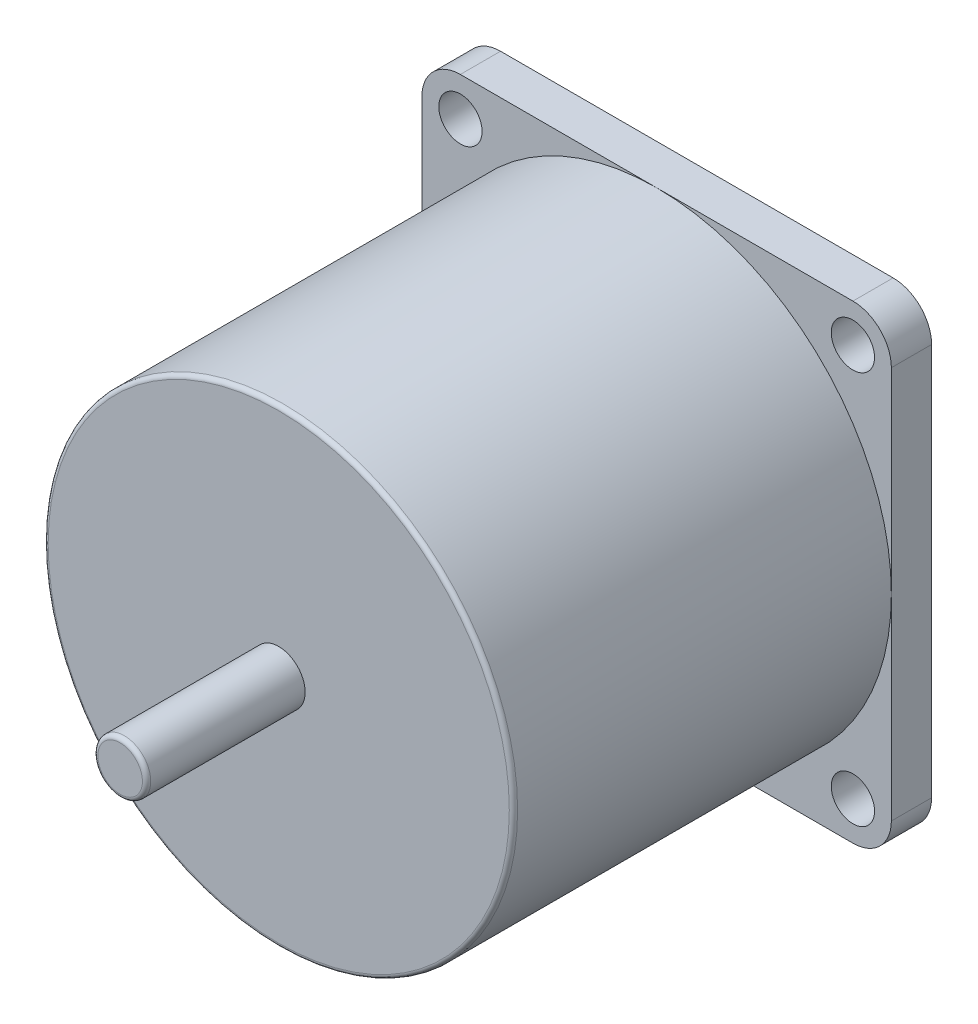
from build123d import *

# Parameters (mm, degrees)
ESBO_O1_R                = 2.6
ESBO_O1_R_2              = 3.175
RESSALTO_EXTRUS_O1_DEPTH = 4.83
RESSALTO_EXTRUS_O2_START = -1.52
ESBO_O2_R                = 19.05
ESBO_O2_R_2              = 3.175
RESSALTO_EXTRUS_O2_DEPTH = 1.52
ESBO_O3_R                = 28.2
RESSALTO_EXTRUS_O3_DEPTH = 45.4
RESSALTO_EXTRUS_O4_START = 20.6
ESBO_O4_R                = 3.175
RESSALTO_EXTRUS_O4_DEPTH = 20.6
FILETE1_R                = 0.5
ESBO_O5_R                = 3.175
RESSALTO_EXTRUS_O5_DEPTH = 19.05
FILETE2_R                = 0.5
FILETE3_R                = 0.5


with BuildPart() as part:
    # Esboço1 → Ressalto-extrusão1 (new body)
    with BuildSketch(Plane.XY):
        with BuildLine():
            Line((-23.58, -28.2), (23.58, -28.2))
            ThreePointArc((23.58, -28.2), (26.846833329, -26.846833329), (28.2, -23.58))
            Line((28.2, -23.58), (28.2, 23.58))
            ThreePointArc((28.2, 23.58), (26.846833329, 26.846833329), (23.58, 28.2))
            Line((23.58, 28.2), (-23.58, 28.2))
            ThreePointArc((-23.58, 28.2), (-26.846833329, 26.846833329), (-28.2, 23.58))
            Line((-28.2, 23.58), (-28.2, -23.58))
            ThreePointArc((-28.2, -23.58), (-26.846833329, -26.846833329), (-23.58, -28.2))
        make_face()
        with Locations((-23.57, 23.57)):
            Circle(ESBO_O1_R, mode=Mode.SUBTRACT)
        with Locations((23.575450692, 23.629295607)):
            Circle(ESBO_O1_R, mode=Mode.SUBTRACT)
        with Locations((23.58, -23.58)):
            Circle(ESBO_O1_R, mode=Mode.SUBTRACT)
        with Locations((-23.58, -23.58)):
            Circle(ESBO_O1_R, mode=Mode.SUBTRACT)
        Circle(ESBO_O1_R_2, mode=Mode.SUBTRACT)
    extrude(amount=RESSALTO_EXTRUS_O1_DEPTH)

    # Esboço2 → Ressalto-extrusão2 (add)
    with BuildSketch(Plane.XY.offset(RESSALTO_EXTRUS_O2_START)):
        Circle(ESBO_O2_R)
        Circle(ESBO_O2_R_2, mode=Mode.SUBTRACT)
    extrude(amount=RESSALTO_EXTRUS_O2_DEPTH)

    # Esboço3 → Ressalto-extrusão3 (add)
    with BuildSketch(Plane.XY.offset(4.83)):
        Circle(ESBO_O3_R)
    extrude(amount=RESSALTO_EXTRUS_O3_DEPTH)

    # Esboço4 → Ressalto-extrusão4 (add)
    with BuildSketch(Plane(origin=(0, 0, 4.83), x_dir=(-1, 0, 0), z_dir=(0, 0, -1)).offset(RESSALTO_EXTRUS_O4_START)):
        with Locations(Location((0, 0, 0), (0, 0, 180))):
            Circle(ESBO_O4_R)
    extrude(amount=-RESSALTO_EXTRUS_O4_DEPTH)

    # Filete1
    filete1_edges = [part.edges().sort_by_distance(p)[0] for p in [
        (-3.175, 0, -15.77),
    ]]
    fillet(filete1_edges, radius=FILETE1_R)

    # Esboço5 → Ressalto-extrusão5 (add)
    with BuildSketch(Plane.XY.offset(50.23)):
        Circle(ESBO_O5_R)
    extrude(amount=RESSALTO_EXTRUS_O5_DEPTH)

    # Filete2
    filete2_edges = [part.edges().sort_by_distance(p)[0] for p in [
        (-3.175, 0, 69.28),
    ]]
    fillet(filete2_edges, radius=FILETE2_R)

    # Filete3
    filete3_edges = [part.edges().sort_by_distance(p)[0] for p in [
        (-28.2, 0, 50.23),
    ]]
    fillet(filete3_edges, radius=FILETE3_R)


solid = part.part
